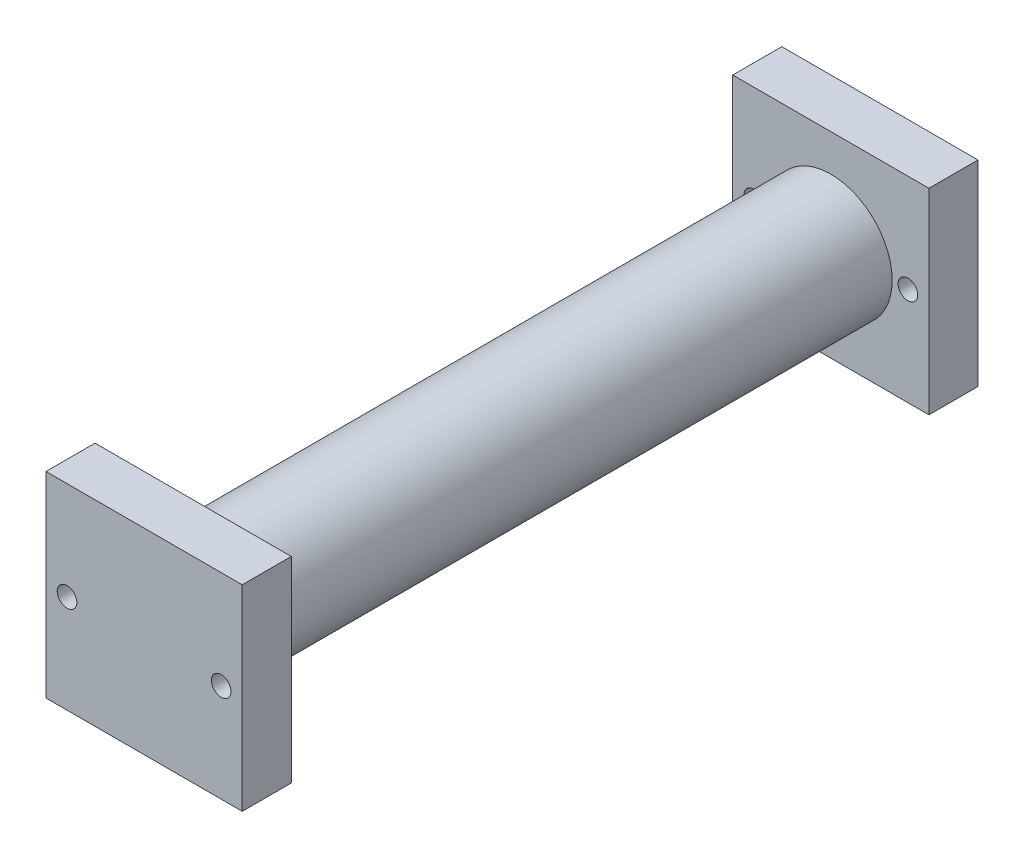
from build123d import *

# Parameters (mm, degrees)
SKETCH_1_W          = 40
SKETCH_1_H          = 40
EXTRUDE_1_DEPTH     = 10
SKETCH_2_R          = 12.5
EXTRUDE_2_DEPTH     = 130
SKETCH_3_W          = 40
SKETCH_3_H          = 40
EXTRUDE_3_DEPTH     = 10
SKETCH_4_R          = 2
CUT_EXTRUDE_1_DEPTH = 10
SKETCH_5_R          = 2
CUT_EXTRUDE_2_DEPTH = 10
CUT_EXTRUDE_START   = -10
SKETCH_6_R          = 2
CUT_EXTRUDE_3_DEPTH = 10
SKETCH_7_R          = 2
CUT_EXTRUDE_4_DEPTH = 10


with BuildPart() as part:
    # 草圖1 → 填料-伸長1 (new body)
    with BuildSketch(Plane.XY):
        Rectangle(SKETCH_1_W, SKETCH_1_H)
    extrude(amount=EXTRUDE_1_DEPTH)

    # 草圖2 → 填料-伸長2 (add)
    with BuildSketch(Plane.XY.offset(10)):
        Circle(SKETCH_2_R)
    extrude(amount=EXTRUDE_2_DEPTH)

    # 草圖3 → 填料-伸長3 (add)
    with BuildSketch(Plane.XY.offset(140)):
        Rectangle(SKETCH_3_W, SKETCH_3_H)
    extrude(amount=EXTRUDE_3_DEPTH)

    # 草圖4 → 除料-伸長1 (cut)
    with BuildSketch(Plane.XY.offset(150)):
        with Locations((-15.713957528, 0)):
            Circle(SKETCH_4_R)
    extrude(amount=-CUT_EXTRUDE_1_DEPTH, mode=Mode.SUBTRACT)

    # 草圖5 → 除料-伸長2 (cut)
    with BuildSketch(Plane.XY.offset(150)):
        with Locations((15.71, 0)):
            Circle(SKETCH_5_R)
    extrude(amount=-CUT_EXTRUDE_2_DEPTH, mode=Mode.SUBTRACT)

    # 草圖6 → 除料-伸長3 (cut)
    with BuildSketch(Plane(origin=(0, 0, 0), x_dir=(-1, 0, 0), z_dir=(0, 0, -1)).offset(CUT_EXTRUDE_START)):
        with Locations(Location((-15.71, 0, 0), (0, 0, 180))):
            Circle(SKETCH_6_R)
    extrude(amount=CUT_EXTRUDE_3_DEPTH, mode=Mode.SUBTRACT)

    # 草圖7 → 除料-伸長4 (cut)
    with BuildSketch(Plane(origin=(0, 0, 0), x_dir=(-1, 0, 0), z_dir=(0, 0, -1))):
        with Locations((15.71, 0)):
            Circle(SKETCH_7_R)
    extrude(amount=-CUT_EXTRUDE_4_DEPTH, mode=Mode.SUBTRACT)


solid = part.part
